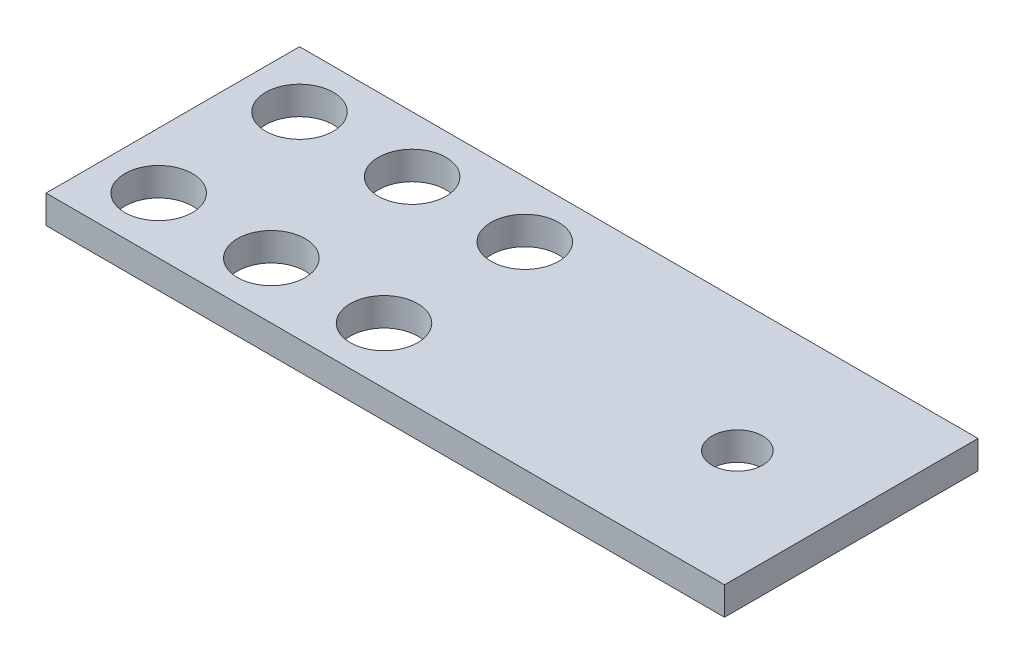
from build123d import *

# Parameters (mm, degrees)
SKETCH1_W                  = 120.45107664
SKETCH1_H                  = 45
BOSS_EXTRUDE1_DEPTH        = 5
F_12_0_12_DIAMETER_HOLE1_D = 12
F_9_0_9_DIAMETER_HOLE1_D   = 9


with BuildPart() as part:
    # Sketch1 → Boss-Extrude1 (new body)
    with BuildSketch(Plane.XZ.offset(-74.218719002)):
        with Locations((-18.22553832, 310.029969029)):
            Rectangle(SKETCH1_W, SKETCH1_H)
    extrude(amount=BOSS_EXTRUDE1_DEPTH)

    # Ø12.0 (12) Diameter Hole1 (through all)
    with Locations(Plane(origin=(0, 74.218719002, 0), x_dir=(1, 0, 0), z_dir=(0, 1, 0))):
        with Locations((-68.45107664, -322.529969029), (-68.45107664, -297.529969029), (-48.45107664, -322.529969029), (-28.45107664, -322.529969029), (-48.45107664, -297.529969029), (-28.45107664, -297.529969029)):
            Hole(F_12_0_12_DIAMETER_HOLE1_D / 2)

    # Ø9.0 (9) Diameter Hole1 (through all)
    with Locations(Plane(origin=(0, 69.218719002, 0), x_dir=(-1, 0, 0), z_dir=(0, -1, 0))):
        with Locations((-22.5, -310.751020034)):
            Hole(F_9_0_9_DIAMETER_HOLE1_D / 2)


solid = part.part
